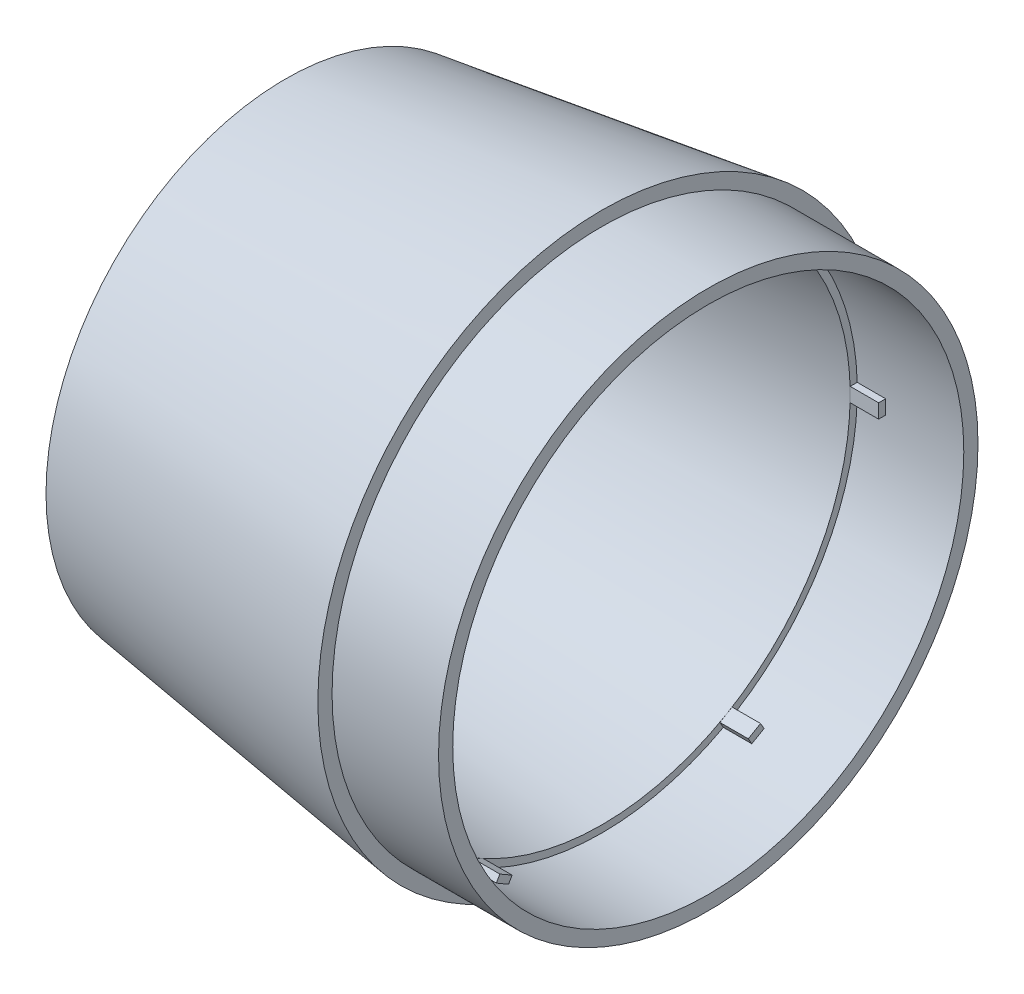
from build123d import *

# Parameters (mm, degrees)
IZIM3_W                     = 4
IZIM3_H                     = 1
Y_KSEKLIK_EKSTR_ZYON1_DEPTH = 1
DAIRESEL_KAPLAMA1_COUNT     = 6


with BuildPart() as part:
    # Çizim1 → Döndür2 (revolve)
    with BuildSketch(Plane.XY):
        Polygon((0, 40), (-44.562063093, 33.737210457), (-44.562063093, 31.737210457), (-33.555064496, 31.737210457), (0, 35), (0, 36), (15, 36), (15, 38), (0, 38), align=None)
    revolve(axis=Axis((-44.316348886, 0, 0), (1, 0, 0)))

    # Çizim3 → Yükseklik-Ekstrüzyon1 (add, symmetric)
    with BuildSketch(Plane(origin=(0, 0, 0), x_dir=(1, 0, 0), z_dir=(0, 1, 0))):
        with Locations((2, -35.5)):
            Rectangle(IZIM3_W, IZIM3_H)
    y_kseklik_ekstr_zyon1 = extrude(amount=Y_KSEKLIK_EKSTR_ZYON1_DEPTH, both=True)

    # Dairesel Kaplama1: Yükseklik-Ekstrüzyon1 ×6 about axis
    dairesel_kaplama1_axis = Axis((0, 0, 0), (-1, 0, 0))
    for i in range(1, DAIRESEL_KAPLAMA1_COUNT):
        add(y_kseklik_ekstr_zyon1.rotate(dairesel_kaplama1_axis, i * 360 / DAIRESEL_KAPLAMA1_COUNT))


solid = part.part
